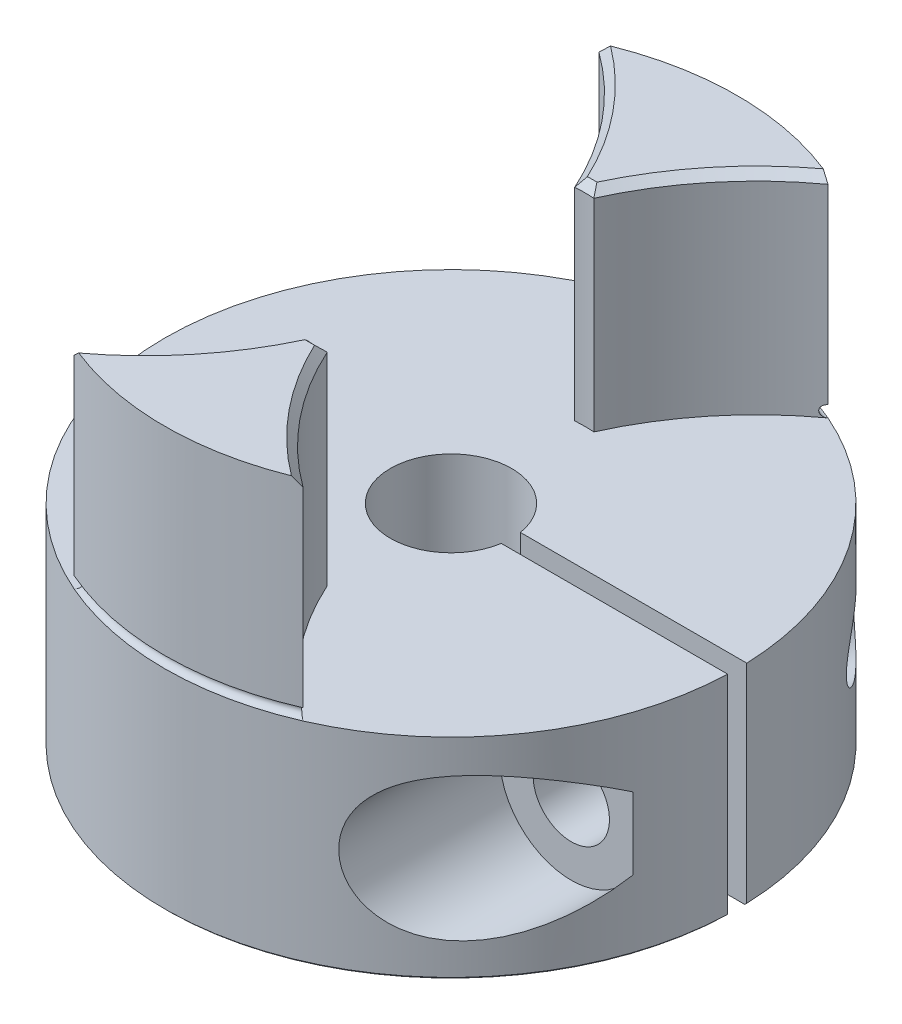
from build123d import *

# Parameters (mm, degrees)
SKETCH1_R                   = 15
BOSS_EXTRUDE1_DEPTH         = 11
SKETCH2_R                   = 7
CUT_EXTRUDE1_DEPTH          = 23
SKETCH3_R                   = 17
CUT_EXTRUDE2_DEPTH          = 11
CUT_EXTRUDE3_DEPTH          = 11
SKETCH5_W                   = 16.165630516
SKETCH5_H                   = 1
CUT_EXTRUDE4_DEPTH          = 21
SKETCH6_R                   = 2
CUT_EXTRUDE5_DEPTH          = 21
CUT_EXTRUDE6_START          = -4.2
SKETCH7_R                   = 3.75
CUT_EXTRUDE6_DEPTH          = 21
M4_TAPPED_HOLE1_D           = 3.3
M4_TAPPED_HOLE1_DEPTH       = 20.1
M4_TAPPED_HOLE1_TIP         = 0.991420021
CHAMFER1_SIZE               = 0.4
SKETCH10_R                  = 0.3
CHAMFER2_SIZE               = 0.1
Y_KSEKLIK_EKSTR_ZYON1_DEPTH = 11


with BuildPart() as part:
    # Sketch1 → Boss-Extrude1 (new, symmetric)
    with BuildSketch(Plane(origin=(0, 0, 0), x_dir=(1, 0, 0), z_dir=(0, 1, 0))):
        with Locations(Location((0, 0, 0), (0, 0, 270))):
            Circle(SKETCH1_R)
    extrude(amount=BOSS_EXTRUDE1_DEPTH, both=True)

    # Sketch2 → Cut-Extrude1 (cut)
    with BuildSketch(Plane(origin=(0, 11, 0), x_dir=(1, 0, 0), z_dir=(0, 1, 0))):
        with Locations(Location((0, 0, 0), (0, 0, 270))):
            Circle(SKETCH2_R)
    extrude(amount=-CUT_EXTRUDE1_DEPTH, mode=Mode.SUBTRACT)

    # Sketch3 → Cut-Extrude2 (cut)
    with BuildSketch(Plane(origin=(0, 11, 0), x_dir=(1, 0, 0), z_dir=(0, 1, 0))):
        with Locations((16, 0)):
            Circle(SKETCH3_R)
    extrude(amount=-CUT_EXTRUDE2_DEPTH, mode=Mode.SUBTRACT)

    # Sketch4 → Cut-Extrude3 (cut)
    with BuildSketch(Plane(origin=(0, 11, 0), x_dir=(1, 0, 0), z_dir=(0, 1, 0))):
        with BuildLine():
            ThreePointArc((-6, 13.747727085), (-15, 0), (-6, -13.747727085))
            ThreePointArc((-6, -13.747727085), (-2.808871931, -10.72353208), (-0.5, -6.982120022))
            ThreePointArc((-0.5, -6.982120022), (-7, 0), (-0.5, 6.982120022))
            ThreePointArc((-0.5, 6.982120022), (-2.808871931, 10.72353208), (-6, 13.747727085))
        make_face()
    extrude(amount=-CUT_EXTRUDE3_DEPTH, mode=Mode.SUBTRACT)

    # Sketch5 → Cut-Extrude4 (cut)
    with BuildSketch(Plane(origin=(0, 0, 0), x_dir=(1, 0, 0), z_dir=(0, 1, 0))):
        with Locations((11.807437966, 0)):
            Rectangle(SKETCH5_W, SKETCH5_H)
    extrude(amount=-CUT_EXTRUDE4_DEPTH, mode=Mode.SUBTRACT)

    # Sketch6 → Cut-Extrude5 (cut)
    with BuildSketch(Plane.XY):
        with Locations(Location((11, -5.5, 0), (0, 0, 180))):
            Circle(SKETCH6_R)
    extrude(amount=CUT_EXTRUDE5_DEPTH, mode=Mode.SUBTRACT)

    # Sketch7 → Cut-Extrude6 (cut)
    with BuildSketch(Plane(origin=(0, 0, 0.5), x_dir=(-1, 0, 0), z_dir=(0, 0, -1)).offset(CUT_EXTRUDE6_START)):
        with Locations((-11, -5.5)):
            Circle(SKETCH7_R)
    extrude(amount=-CUT_EXTRUDE6_DEPTH, mode=Mode.SUBTRACT)

    # M4 Tapped Hole1
    with Locations(Plane.XY.offset(-0.5)):
        with Locations((11, -5.5)):
            Hole(M4_TAPPED_HOLE1_D / 2, depth=M4_TAPPED_HOLE1_DEPTH)
            with Locations((0, 0, -(M4_TAPPED_HOLE1_DEPTH + M4_TAPPED_HOLE1_TIP / 2))):  # 118° drill point
                Cone(0, M4_TAPPED_HOLE1_D / 2, M4_TAPPED_HOLE1_TIP, mode=Mode.SUBTRACT)

    # Chamfer1
    chamfer1_edges = [part.edges().sort_by_distance(p)[0] for p in [
        (0, 11, -7),
        (2.808871931, 11, 10.72353208),
        (2.808871931, 11, -10.72353208),
        (0, 11, 7),
        (-2.808871931, 11, -10.72353208),
        (-2.808871931, 11, 10.72353208),
    ]]
    chamfer(chamfer1_edges, length=CHAMFER1_SIZE)

    # Sketch10 → Cut-Revolve1 (revolve, cut)
    with BuildSketch(Plane(origin=(0, 0, 0), x_dir=(0, 0, -1), z_dir=(1, 0, 0))):
        with Locations((15, 0.3)):
            Circle(SKETCH10_R)
    revolve(axis=Axis((0, 3.360414074, 0), (0, -1, 0)), mode=Mode.SUBTRACT)

    # Chamfer2
    chamfer2_edges = [part.edges().sort_by_distance(p)[0] for p in [
        (-15, -11, 0),
    ]]
    chamfer(chamfer2_edges, length=CHAMFER2_SIZE)

    # Çizim1 → Yükseklik-Ekstrüzyon1 (add)
    with BuildSketch(Plane(origin=(0, 0, 0), x_dir=(1, 0, 0), z_dir=(0, 1, 0))):
        with BuildLine():
            Line((6.982120022, 0.5), (3.135382752, 0.5))
            ThreePointArc((3.135382752, 0.5), (-3.175, 0), (3.135382752, -0.5))
            Line((3.135382752, -0.5), (6.982120022, -0.5))
            ThreePointArc((6.982120022, -0.5), (-7, 0), (6.982120022, 0.5))
        make_face()
    extrude(amount=-Y_KSEKLIK_EKSTR_ZYON1_DEPTH)


solid = part.part
